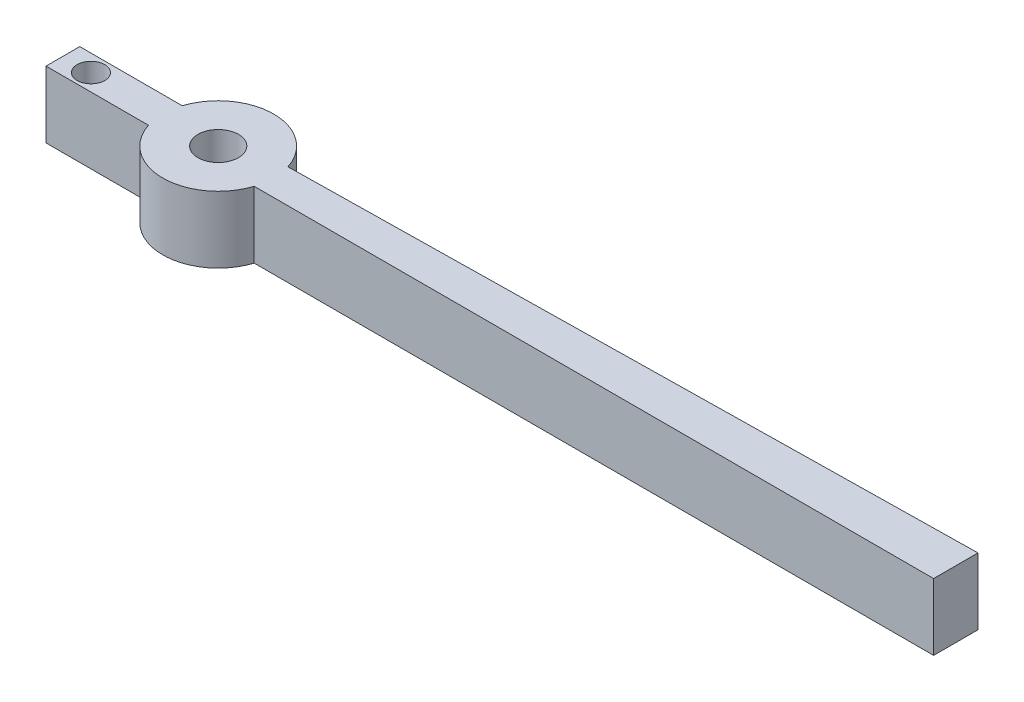
from build123d import *

# Parameters (mm, degrees)
BOSS_EXTRUDE1_DEPTH      = 15
BOSS_EXTRUDE1_DEPTH_BACK = 15
SKETCH1_R                = 9.12611675
SKETCH1_R_2              = 6.232505418


with BuildPart() as part:
    # Sketch1 → Boss-Extrude1 (new, two sides: drawn at the far end of the back side and taken through both)
    with BuildSketch(Plane(origin=(0, 0, 0), x_dir=(1, 0, 0), z_dir=(0, 1, 0)).offset(-BOSS_EXTRUDE1_DEPTH_BACK)):
        with BuildLine():
            Line((-194.484920724, -50.304604359), (-148.298710109, -50.304604359))
            ThreePointArc((-148.298710109, -50.304604359), (-124.484920724, -32.914035031), (-100.67113134, -50.304604359))
            Line((-100.67113134, -50.304604359), (205.515079276, -45.523465704))
            Line((205.515079276, -45.523465704), (205.515079276, -65.523465704))
            Line((205.515079276, -65.523465704), (-100.67113134, -65.523465704))
            ThreePointArc((-100.67113134, -65.523465704), (-124.484920724, -82.914035031), (-148.298710109, -65.523465704))
            Line((-148.298710109, -65.523465704), (-194.484920724, -65.523465704))
            Line((-194.484920724, -65.523465704), (-194.484920724, -50.304604359))
        make_face()
        with Locations((-124.484920724, -57.914035031)):
            Circle(SKETCH1_R, mode=Mode.SUBTRACT)
        with Locations((-181.826571095, -57.914035031)):
            Circle(SKETCH1_R_2, mode=Mode.SUBTRACT)
    extrude(amount=BOSS_EXTRUDE1_DEPTH + BOSS_EXTRUDE1_DEPTH_BACK)


solid = part.part
